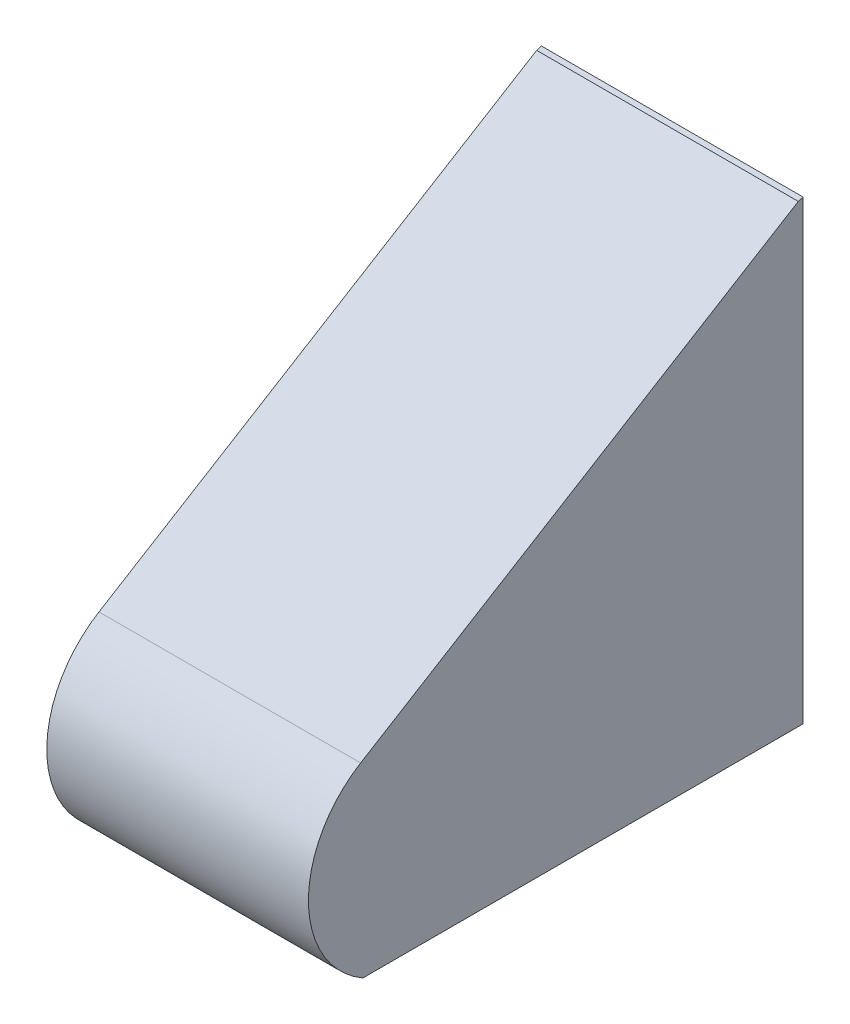
from build123d import *

# Parameters (mm, degrees)
BOSS_EXTRUDE1_DEPTH      = 63.5
BOSS_EXTRUDE1_DEPTH_BACK = 63.5
BOSS_EXTRUDE2_DEPTH      = 4.826


with BuildPart() as part:
    # Sketch1 → Boss-Extrude1 (new, two sides: drawn at the far end of the back side and taken through both)
    with BuildSketch(Plane(origin=(0, 0, 0), x_dir=(0, 0, -1), z_dir=(1, 0, 0)).offset(-BOSS_EXTRUDE1_DEPTH_BACK)):
        with BuildLine():
            Line((0, -114.3), (-228.6, -114.3))
            ThreePointArc((-228.6, -114.3), (-253.529098735, -69.85), (-228.6, -25.4))
            Line((-228.6, -25.4), (0, 114.3))
            Line((0, 114.3), (0, 119.126))
            Line((0, 119.126), (-2.516517746, 118.417938129))
            Line((-2.516517746, 118.417938129), (-231.116517746, -21.282061871))
            ThreePointArc((-231.116517746, -21.282061871), (-258.35088249, -70.54278495), (-229.92552978, -119.126))
            Line((-229.92552978, -119.126), (0, -119.126))
            Line((0, -119.126), (0, -114.3))
        make_face()
    extrude(amount=BOSS_EXTRUDE1_DEPTH + BOSS_EXTRUDE1_DEPTH_BACK)

    # Sketch2 → Boss-Extrude2 (add)
    with BuildSketch(Plane(origin=(63.5, 0, 0), x_dir=(0, 0, -1), z_dir=(1, 0, 0))):
        with BuildLine():
            Line((-229.92552978, -119.126), (0, -119.126))
            Line((0, -119.126), (0, 119.126))
            Line((0, 119.126), (-2.516517746, 118.417938129))
            Line((-2.516517746, 118.417938129), (-231.116517746, -21.282061871))
            ThreePointArc((-231.116517746, -21.282061871), (-258.35088249, -70.54278495), (-229.92552978, -119.126))
        make_face()
    boss_extrude2 = extrude(amount=BOSS_EXTRUDE2_DEPTH)

    # Mirror1: Boss-Extrude2 across plane
    add(boss_extrude2.mirror(Plane(origin=(0, 0, 0), x_dir=(0, 0, 1), z_dir=(1, 0, 0))))


solid = part.part
